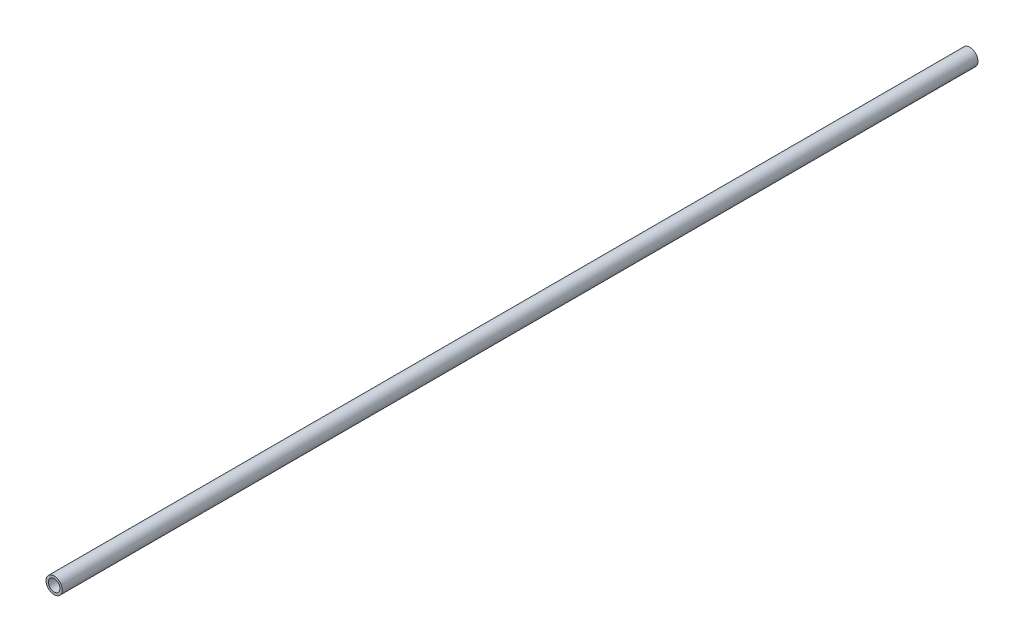
from build123d import *

# Parameters (mm, degrees)
SKETCH1_R           = 4.4704
SKETCH1_R_2         = 3.175
BOSS_EXTRUDE1_DEPTH = 502.539


with BuildPart() as part:
    # Sketch1 → Boss-Extrude1 (new body)
    with BuildSketch(Plane.XY):
        with Locations((0, 6.455764706)):
            Circle(SKETCH1_R)
        with Locations((0, 6.455764706)):
            Circle(SKETCH1_R_2, mode=Mode.SUBTRACT)
    extrude(amount=BOSS_EXTRUDE1_DEPTH)


solid = part.part
